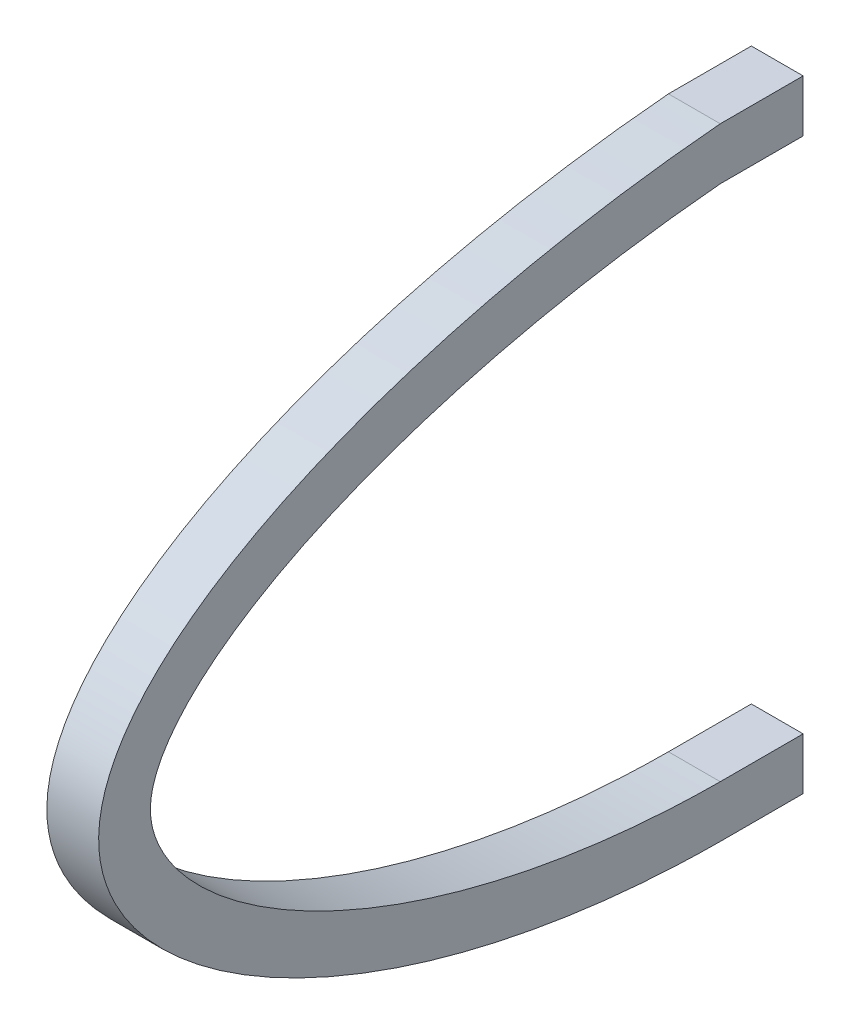
from build123d import *

# Parameters (mm, degrees)
SKETCH1_W           = 8
SKETCH1_H           = 5.019775665
SKETCH1_H_2         = 5.000079271
BOSS_EXTRUDE1_DEPTH = 2.5


with BuildPart() as part:
    # Sketch1 → Boss-Extrude1 (new, symmetric)
    with BuildSketch(Plane(origin=(0, 0, 0), x_dir=(0, 0, -1), z_dir=(1, 0, 0))):
        with Locations((4, 27.499960365)):
            Rectangle(SKETCH1_W, SKETCH1_H)
        with BuildLine():
            Line((0, 24.990072532), (0, 30.009848197))
            add(Edge.make_bspline(
                [(0, 30.009848197), (-33.86579225, 27.041150989), (-86.598907035, 1.388015973), (-32.936513937, -29.809139945), (0, -29.990151803)],
                knots=[0, 0, 0, 0, 0.500032233, 1, 1, 1, 1], degree=3))
            Line((0, -29.990151803), (0, -24.990072532))
            add(Edge.make_bspline(
                [(0, 24.990072532), (-0.874878037, 24.910941626), (-2.773381276, 24.723439478), (-6.637465037, 24.271119383), (-11.52538346, 23.552462655), (-17.15052597, 22.493130462), (-24.295280127, 20.83621559), (-32.479548288, 18.343078036), (-40.850606179, 14.806160146), (-47.50111078, 10.893230546), (-52.159077464, 6.846024154), (-54.215188723, 3.725292558), (-54.911009064, 1.572589398), (-55.058104509, 0.096957705), (-54.860790714, -1.456156859), (-54.040578596, -3.835959661), (-51.765730232, -7.299916825), (-46.924474198, -11.709889483), (-40.207740933, -15.914430517), (-31.891205185, -19.603723156), (-23.858415521, -22.039842353), (-16.903772623, -23.496824111), (-11.457047295, -24.318148677), (-6.749422146, -24.755653572), (-2.914159138, -24.94491655), (-0.965658494, -24.98449789), (0, -24.990072532)],
                knots=[0.002229315, 0.002229315, 0.002229315, 0.002229315, 0.015625, 0.03125, 0.0625, 0.09375, 0.125, 0.1875, 0.25, 0.3125, 0.375, 0.4375, 0.46875, 0.5, 0.53125, 0.5625, 0.625, 0.6875, 0.75, 0.8125, 0.875, 0.90625, 0.9375, 0.96875, 0.984375, 0.99985318, 0.99985318, 0.99985318, 0.99985318], degree=3))
        make_face()
        with Locations((4, -27.490112168)):
            Rectangle(SKETCH1_W, SKETCH1_H_2)
    extrude(amount=BOSS_EXTRUDE1_DEPTH, both=True)


solid = part.part
